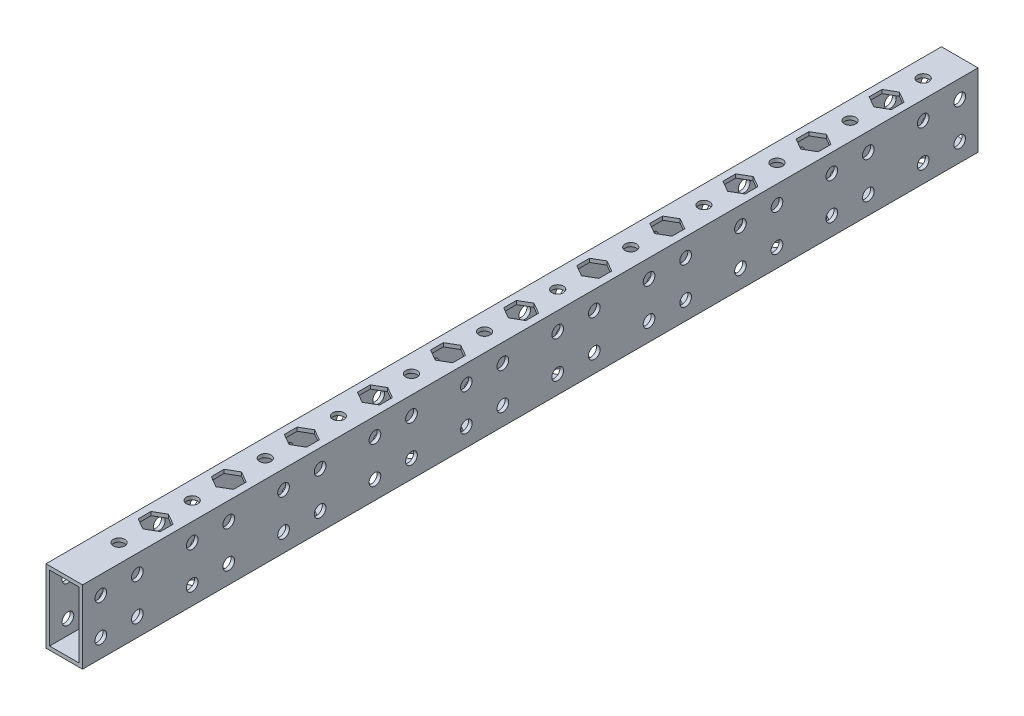
from build123d import *

# Parameters (mm, degrees)
SKETCH_1_W          = 10
SKETCH_1_H          = 20
SKETCH_1_W_2        = 8
SKETCH_1_H_2        = 18
EXTRUDE_1_DEPTH     = 245
SKETCH_2_R          = 1.575
CUT_EXTRUDE_1_DEPTH = 247.018292003
SKETCH_3_R          = 1.6
CUT_EXTRUDE_2_DEPTH = 247.018292003


with BuildPart() as part:
    # 草图1 → 拉伸-薄壁1 (new body)
    with BuildSketch(Plane.XY):
        with Locations((5, -10)):
            Rectangle(SKETCH_1_W, SKETCH_1_H)
        with Locations((5, -10)):
            Rectangle(SKETCH_1_W_2, SKETCH_1_H_2, mode=Mode.SUBTRACT)
    extrude(amount=EXTRUDE_1_DEPTH)

    # 草图2 → 切除-拉伸1 (cut, through all)
    with BuildSketch(Plane.XZ.offset(20)):
        with Locations(Location((5, 10, 0), (0, 0, 270))):
            Circle(SKETCH_2_R)
        with Locations(Location((5, 30, 0), (0, 0, 270))):
            Circle(SKETCH_2_R)
        with Locations(Location((5, 50, 0), (0, 0, 270))):
            Circle(SKETCH_2_R)
        with Locations(Location((5, 70, 0), (0, 0, 270))):
            Circle(SKETCH_2_R)
        with Locations(Location((5, 90, 0), (0, 0, 270))):
            Circle(SKETCH_2_R)
        with Locations(Location((5, 110, 0), (0, 0, 270))):
            Circle(SKETCH_2_R)
        with Locations(Location((5, 130, 0), (0, 0, 270))):
            Circle(SKETCH_2_R)
        with Locations(Location((5, 150, 0), (0, 0, 270))):
            Circle(SKETCH_2_R)
        with Locations(Location((5, 170, 0), (0, 0, 270))):
            Circle(SKETCH_2_R)
        with Locations(Location((5, 190, 0), (0, 0, 270))):
            Circle(SKETCH_2_R)
        with Locations(Location((5, 210, 0), (0, 0, 270))):
            Circle(SKETCH_2_R)
        with Locations(Location((5, 230, 0), (0, 0, 270))):
            Circle(SKETCH_2_R)
        Polygon((5, 23.5), (1.968911087, 21.75), (1.968911087, 18.25), (5, 16.5), (8.031088913, 18.25), (8.031088913, 21.75), align=None)
        Polygon((5, 43.5), (1.968911087, 41.75), (1.968911087, 38.25), (5, 36.5), (8.031088913, 38.25), (8.031088913, 41.75), align=None)
        Polygon((5, 63.5), (1.968911087, 61.75), (1.968911087, 58.25), (5, 56.5), (8.031088913, 58.25), (8.031088913, 61.75), align=None)
        Polygon((5, 83.5), (1.968911087, 81.75), (1.968911087, 78.25), (5, 76.5), (8.031088913, 78.25), (8.031088913, 81.75), align=None)
        Polygon((5, 103.5), (1.968911087, 101.75), (1.968911087, 98.25), (5, 96.5), (8.031088913, 98.25), (8.031088913, 101.75), align=None)
        Polygon((5, 123.5), (1.968911087, 121.75), (1.968911087, 118.25), (5, 116.5), (8.031088913, 118.25), (8.031088913, 121.75), align=None)
        Polygon((5, 143.5), (1.968911087, 141.75), (1.968911087, 138.25), (5, 136.5), (8.031088913, 138.25), (8.031088913, 141.75), align=None)
        Polygon((5, 163.5), (1.968911087, 161.75), (1.968911087, 158.25), (5, 156.5), (8.031088913, 158.25), (8.031088913, 161.75), align=None)
        Polygon((5, 183.5), (1.968911087, 181.75), (1.968911087, 178.25), (5, 176.5), (8.031088913, 178.25), (8.031088913, 181.75), align=None)
        Polygon((5, 203.5), (1.968911087, 201.75), (1.968911087, 198.25), (5, 196.5), (8.031088913, 198.25), (8.031088913, 201.75), align=None)
        Polygon((5, 223.5), (1.968911087, 221.75), (1.968911087, 218.25), (5, 216.5), (8.031088913, 218.25), (8.031088913, 221.75), align=None)
    extrude(amount=-CUT_EXTRUDE_1_DEPTH, mode=Mode.SUBTRACT)

    # 草图3 → 切除-拉伸2 (cut, through all)
    with BuildSketch(Plane.ZY):
        with Locations(Location((240, -5, 0), (0, 0, 270))):
            Circle(SKETCH_3_R)
        with Locations(Location((240, -15, 0), (0, 0, 270))):
            Circle(SKETCH_3_R)
        with Locations(Location((230, -15, 0), (0, 0, 270))):
            Circle(SKETCH_3_R)
        with Locations(Location((230, -5, 0), (0, 0, 270))):
            Circle(SKETCH_3_R)
        with Locations(Location((15, -5, 0), (0, 0, 270))):
            Circle(SKETCH_3_R)
        with Locations(Location((15, -15, 0), (0, 0, 270))):
            Circle(SKETCH_3_R)
        with Locations(Location((5, -15, 0), (0, 0, 270))):
            Circle(SKETCH_3_R)
        with Locations(Location((5, -5, 0), (0, 0, 270))):
            Circle(SKETCH_3_R)
        with Locations(Location((30, -5, 0), (0, 0, 270))):
            Circle(SKETCH_3_R)
        with Locations(Location((40, -5, 0), (0, 0, 270))):
            Circle(SKETCH_3_R)
        with Locations(Location((40, -15, 0), (0, 0, 270))):
            Circle(SKETCH_3_R)
        with Locations(Location((30, -15, 0), (0, 0, 270))):
            Circle(SKETCH_3_R)
        with Locations(Location((55, -5, 0), (0, 0, 270))):
            Circle(SKETCH_3_R)
        with Locations(Location((65, -5, 0), (0, 0, 270))):
            Circle(SKETCH_3_R)
        with Locations(Location((65, -15, 0), (0, 0, 270))):
            Circle(SKETCH_3_R)
        with Locations(Location((55, -15, 0), (0, 0, 270))):
            Circle(SKETCH_3_R)
        with Locations(Location((80, -5, 0), (0, 0, 270))):
            Circle(SKETCH_3_R)
        with Locations(Location((90, -5, 0), (0, 0, 270))):
            Circle(SKETCH_3_R)
        with Locations(Location((90, -15, 0), (0, 0, 270))):
            Circle(SKETCH_3_R)
        with Locations(Location((80, -15, 0), (0, 0, 270))):
            Circle(SKETCH_3_R)
        with Locations(Location((105, -5, 0), (0, 0, 270))):
            Circle(SKETCH_3_R)
        with Locations(Location((115, -5, 0), (0, 0, 270))):
            Circle(SKETCH_3_R)
        with Locations(Location((115, -15, 0), (0, 0, 270))):
            Circle(SKETCH_3_R)
        with Locations(Location((105, -15, 0), (0, 0, 270))):
            Circle(SKETCH_3_R)
        with Locations(Location((140, -15, 0), (0, 0, 270))):
            Circle(SKETCH_3_R)
        with Locations(Location((130, -15, 0), (0, 0, 270))):
            Circle(SKETCH_3_R)
        with Locations(Location((130, -5, 0), (0, 0, 270))):
            Circle(SKETCH_3_R)
        with Locations(Location((140, -5, 0), (0, 0, 270))):
            Circle(SKETCH_3_R)
        with Locations(Location((165, -15, 0), (0, 0, 270))):
            Circle(SKETCH_3_R)
        with Locations(Location((155, -15, 0), (0, 0, 270))):
            Circle(SKETCH_3_R)
        with Locations(Location((155, -5, 0), (0, 0, 270))):
            Circle(SKETCH_3_R)
        with Locations(Location((165, -5, 0), (0, 0, 270))):
            Circle(SKETCH_3_R)
        with Locations(Location((190, -15, 0), (0, 0, 270))):
            Circle(SKETCH_3_R)
        with Locations(Location((180, -15, 0), (0, 0, 270))):
            Circle(SKETCH_3_R)
        with Locations(Location((180, -5, 0), (0, 0, 270))):
            Circle(SKETCH_3_R)
        with Locations(Location((190, -5, 0), (0, 0, 270))):
            Circle(SKETCH_3_R)
        with Locations(Location((215, -15, 0), (0, 0, 270))):
            Circle(SKETCH_3_R)
        with Locations(Location((205, -15, 0), (0, 0, 270))):
            Circle(SKETCH_3_R)
        with Locations(Location((205, -5, 0), (0, 0, 270))):
            Circle(SKETCH_3_R)
        with Locations(Location((215, -5, 0), (0, 0, 270))):
            Circle(SKETCH_3_R)
    extrude(amount=-CUT_EXTRUDE_2_DEPTH, mode=Mode.SUBTRACT)


solid = part.part
